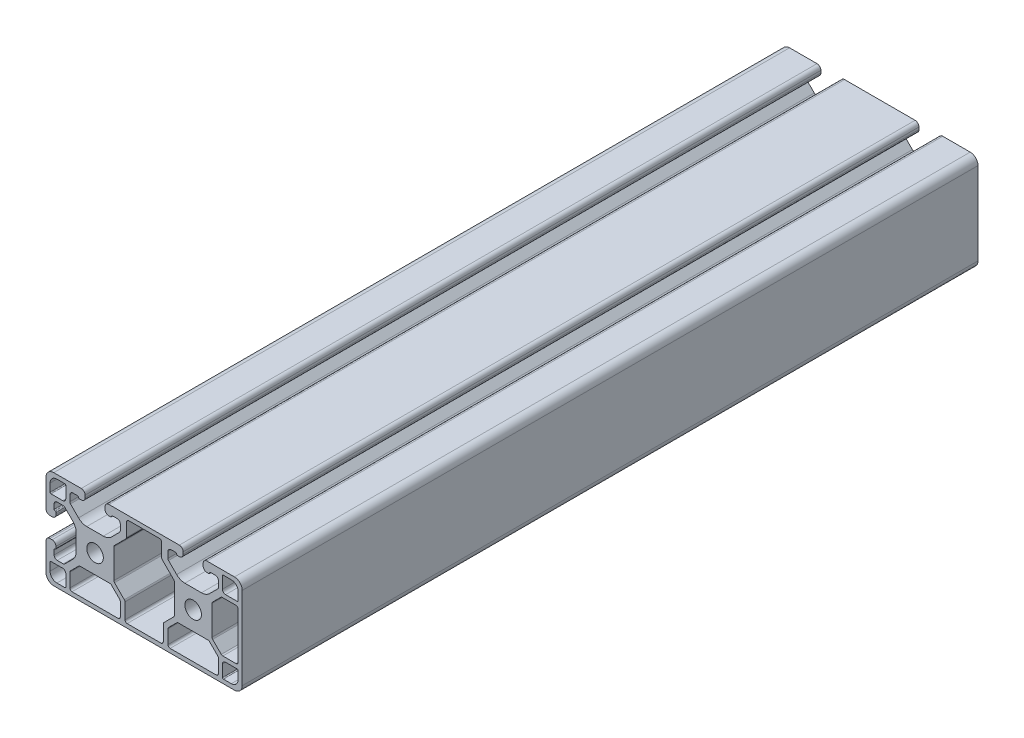
from build123d import *

# Parameters (mm, degrees)
SKETCH1_R      = 3.377777778
EXTRUDE1_DEPTH = 300


with BuildPart() as part:
    # Sketch1 → Extrude1 (new body)
    with BuildSketch(Plane.XY):
        with BuildLine():
            Line((16.825396825, 20), (5.638095238, 20))
            ThreePointArc((5.638095238, 20), (4.524682656, 19.538809408), (4.063492063, 18.425396825))
            Line((4.063492063, 18.425396825), (4.063492063, 17.511111111))
            ThreePointArc((4.063492063, 17.511111111), (4.524682656, 16.397698529), (5.638095238, 15.936507937))
            Line((5.638095238, 15.936507937), (6.344572699, 15.936507937))
            ThreePointArc((6.344572699, 15.936507937), (6.608509887, 16.043145483), (6.724293748, 16.303200291))
            Line((6.724293748, 16.303200291), (6.72528969, 16.331720344))
            ThreePointArc((6.72528969, 16.331720344), (6.84107355, 16.591775152), (7.105010739, 16.698412698))
            Line((7.105010739, 16.698412698), (9.015873016, 16.698412698))
            ThreePointArc((9.015873016, 16.698412698), (9.913786389, 16.326484802), (10.285714286, 15.428571429))
            Line((10.285714286, 15.428571429), (10.285714286, 12.988478889))
            ThreePointArc((10.285714286, 12.988478889), (10.218051648, 12.648315838), (10.025364758, 12.359939528))
            Line((10.025364758, 12.359939528), (6.738975247, 9.073550017))
            ThreePointArc((6.738975247, 9.073550017), (5.198221819, 8.04405149), (3.380779233, 7.682539683))
            Line((3.380779233, 7.682539683), (-3.380779233, 7.682539683))
            ThreePointArc((-3.380779233, 7.682539683), (-5.198221819, 8.04405149), (-6.738975247, 9.073550017))
            Line((-6.738975247, 9.073550017), (-10.025364758, 12.359939528))
            ThreePointArc((-10.025364758, 12.359939528), (-10.218051648, 12.648315838), (-10.285714286, 12.988478889))
            Line((-10.285714286, 12.988478889), (-10.285714286, 15.428571429))
            ThreePointArc((-10.285714286, 15.428571429), (-9.913786389, 16.326484802), (-9.015873016, 16.698412698))
            Line((-9.015873016, 16.698412698), (-7.105010739, 16.698412698))
            ThreePointArc((-7.105010739, 16.698412698), (-6.84107355, 16.591775152), (-6.72528969, 16.331720344))
            Line((-6.72528969, 16.331720344), (-6.724293748, 16.303200291))
            ThreePointArc((-6.724293748, 16.303200291), (-6.608509887, 16.043145483), (-6.344572699, 15.936507937))
            Line((-6.344572699, 15.936507937), (-5.638095238, 15.936507937))
            ThreePointArc((-5.638095238, 15.936507937), (-4.524682656, 16.397698529), (-4.063492063, 17.511111111))
            Line((-4.063492063, 17.511111111), (-4.063492063, 18.425396825))
            ThreePointArc((-4.063492063, 18.425396825), (-4.524682656, 19.538809408), (-5.638095238, 20))
            Line((-5.638095238, 20), (-34.361904762, 20))
            ThreePointArc((-34.361904762, 20), (-35.475317344, 19.538809408), (-35.936507937, 18.425396825))
            Line((-35.936507937, 18.425396825), (-35.936507937, 17.511111111))
            ThreePointArc((-35.936507937, 17.511111111), (-35.475317344, 16.397698529), (-34.361904762, 15.936507937))
            Line((-34.361904762, 15.936507937), (-33.655427301, 15.936507937))
            ThreePointArc((-33.655427301, 15.936507937), (-33.391490113, 16.043145483), (-33.275706252, 16.303200291))
            Line((-33.275706252, 16.303200291), (-33.27471031, 16.331720344))
            ThreePointArc((-33.27471031, 16.331720344), (-33.15892645, 16.591775152), (-32.894989261, 16.698412698))
            Line((-32.894989261, 16.698412698), (-30.984126984, 16.698412698))
            ThreePointArc((-30.984126984, 16.698412698), (-30.086213611, 16.326484802), (-29.714285714, 15.428571429))
            Line((-29.714285714, 15.428571429), (-29.714285714, 12.988478889))
            ThreePointArc((-29.714285714, 12.988478889), (-29.781948352, 12.648315838), (-29.974635242, 12.359939528))
            Line((-29.974635242, 12.359939528), (-33.261024753, 9.073550017))
            ThreePointArc((-33.261024753, 9.073550017), (-34.801778181, 8.04405149), (-36.619220767, 7.682539683))
            Line((-36.619220767, 7.682539683), (-43.380779233, 7.682539683))
            ThreePointArc((-43.380779233, 7.682539683), (-45.198221819, 8.04405149), (-46.738975247, 9.073550017))
            Line((-46.738975247, 9.073550017), (-50.025364758, 12.359939528))
            ThreePointArc((-50.025364758, 12.359939528), (-50.218051648, 12.648315838), (-50.285714286, 12.988478889))
            Line((-50.285714286, 12.988478889), (-50.285714286, 15.428571429))
            ThreePointArc((-50.285714286, 15.428571429), (-49.913786389, 16.326484802), (-49.015873016, 16.698412698))
            Line((-49.015873016, 16.698412698), (-47.105010739, 16.698412698))
            ThreePointArc((-47.105010739, 16.698412698), (-46.84107355, 16.591775152), (-46.72528969, 16.331720344))
            Line((-46.72528969, 16.331720344), (-46.724293748, 16.303200291))
            ThreePointArc((-46.724293748, 16.303200291), (-46.608509887, 16.043145483), (-46.344572699, 15.936507937))
            Line((-46.344572699, 15.936507937), (-45.638095238, 15.936507937))
            ThreePointArc((-45.638095238, 15.936507937), (-44.524682656, 16.397698529), (-44.063492063, 17.511111111))
            Line((-44.063492063, 17.511111111), (-44.063492063, 18.425396825))
            ThreePointArc((-44.063492063, 18.425396825), (-44.524682656, 19.538809408), (-45.638095238, 20))
            Line((-45.638095238, 20), (-56.825396825, 20))
            ThreePointArc((-56.825396825, 20), (-59.070180258, 19.070180258), (-60, 16.825396825))
            Line((-60, 16.825396825), (-60, 5.638095238))
            ThreePointArc((-60, 5.638095238), (-59.538809408, 4.524682656), (-58.425396825, 4.063492063))
            Line((-58.425396825, 4.063492063), (-57.511111111, 4.063492063))
            ThreePointArc((-57.511111111, 4.063492063), (-56.397698529, 4.524682656), (-55.936507937, 5.638095238))
            Line((-55.936507937, 5.638095238), (-55.936507937, 6.344572699))
            ThreePointArc((-55.936507937, 6.344572699), (-56.043145483, 6.608509887), (-56.303200291, 6.724293748))
            Line((-56.303200291, 6.724293748), (-56.331720344, 6.72528969))
            ThreePointArc((-56.331720344, 6.72528969), (-56.591775152, 6.84107355), (-56.698412698, 7.105010739))
            Line((-56.698412698, 7.105010739), (-56.698412698, 9.015873016))
            ThreePointArc((-56.698412698, 9.015873016), (-56.326484802, 9.913786389), (-55.428571429, 10.285714286))
            Line((-55.428571429, 10.285714286), (-52.988478889, 10.285714286))
            ThreePointArc((-52.988478889, 10.285714286), (-52.648315838, 10.218051648), (-52.359939528, 10.025364758))
            Line((-52.359939528, 10.025364758), (-49.073550017, 6.738975247))
            ThreePointArc((-49.073550017, 6.738975247), (-48.04405149, 5.198221819), (-47.682539683, 3.380779233))
            Line((-47.682539683, 3.380779233), (-47.682539683, -3.380779233))
            ThreePointArc((-47.682539683, -3.380779233), (-48.04405149, -5.198221819), (-49.073550017, -6.738975247))
            Line((-49.073550017, -6.738975247), (-52.359939528, -10.025364758))
            ThreePointArc((-52.359939528, -10.025364758), (-52.648315838, -10.218051648), (-52.988478889, -10.285714286))
            Line((-52.988478889, -10.285714286), (-55.428571429, -10.285714286))
            ThreePointArc((-55.428571429, -10.285714286), (-56.326484802, -9.913786389), (-56.698412698, -9.015873016))
            Line((-56.698412698, -9.015873016), (-56.698412698, -7.105010739))
            ThreePointArc((-56.698412698, -7.105010739), (-56.591775152, -6.84107355), (-56.331720344, -6.72528969))
            Line((-56.331720344, -6.72528969), (-56.303200291, -6.724293748))
            ThreePointArc((-56.303200291, -6.724293748), (-56.043145483, -6.608509887), (-55.936507937, -6.344572699))
            Line((-55.936507937, -6.344572699), (-55.936507937, -5.638095238))
            ThreePointArc((-55.936507937, -5.638095238), (-56.397698529, -4.524682656), (-57.511111111, -4.063492063))
            Line((-57.511111111, -4.063492063), (-58.425396825, -4.063492063))
            ThreePointArc((-58.425396825, -4.063492063), (-59.538809408, -4.524682656), (-60, -5.638095238))
            Line((-60, -5.638095238), (-60, -16.825396825))
            ThreePointArc((-60, -16.825396825), (-59.070180258, -19.070180258), (-56.825396825, -20))
            Line((-56.825396825, -20), (16.825396825, -20))
            ThreePointArc((16.825396825, -20), (19.070180258, -19.070180258), (20, -16.825396825))
            Line((20, -16.825396825), (20, 16.825396825))
            ThreePointArc((20, 16.825396825), (19.070180258, 19.070180258), (16.825396825, 20))
        make_face()
        Circle(SKETCH1_R, mode=Mode.SUBTRACT)
        with Locations((-40, 0)):
            Circle(SKETCH1_R, mode=Mode.SUBTRACT)
        with BuildLine():
            Line((-57.969507937, -11.936507937), (-53.206349206, -11.936507937))
            ThreePointArc((-53.206349206, -11.936507937), (-52.308435833, -12.308435833), (-51.936507937, -13.206349206))
            Line((-51.936507937, -13.206349206), (-51.936507937, -17.969253843))
            ThreePointArc((-51.936507937, -17.969253843), (-52.047793449, -18.237920837), (-52.316460442, -18.349206349))
            Line((-52.316460442, -18.349206349), (-55.555507937, -18.349206349))
            ThreePointArc((-55.555507937, -18.349206349), (-57.531164283, -17.530862696), (-58.349507937, -15.555206349))
            Line((-58.349507937, -15.555206349), (-58.349507937, -12.316507937))
            ThreePointArc((-58.349507937, -12.316507937), (-58.238208513, -12.04780736), (-57.969507937, -11.936507937))
        make_face(mode=Mode.SUBTRACT)
        with BuildLine():
            Line((-53.206349206, 11.936507937), (-57.969507937, 11.936507937))
            ThreePointArc((-57.969507937, 11.936507937), (-58.238208513, 12.04780736), (-58.349507937, 12.316507937))
            Line((-58.349507937, 12.316507937), (-58.349507937, 15.555206349))
            ThreePointArc((-58.349507937, 15.555206349), (-57.531164283, 17.530862696), (-55.555507937, 18.349206349))
            Line((-55.555507937, 18.349206349), (-52.316460442, 18.349206349))
            ThreePointArc((-52.316460442, 18.349206349), (-52.047793449, 18.237920837), (-51.936507937, 17.969253843))
            Line((-51.936507937, 17.969253843), (-51.936507937, 13.206349206))
            ThreePointArc((-51.936507937, 13.206349206), (-52.308435833, 12.308435833), (-53.206349206, 11.936507937))
        make_face(mode=Mode.SUBTRACT)
        with BuildLine():
            Line((13.206349206, -11.936507937), (17.969507937, -11.936507937))
            ThreePointArc((17.969507937, -11.936507937), (18.238208513, -12.04780736), (18.349507937, -12.316507937))
            Line((18.349507937, -12.316507937), (18.349507937, -15.555206349))
            ThreePointArc((18.349507937, -15.555206349), (17.531164283, -17.530862696), (15.555507937, -18.349206349))
            Line((15.555507937, -18.349206349), (12.316460442, -18.349206349))
            ThreePointArc((12.316460442, -18.349206349), (12.047793449, -18.237920837), (11.936507937, -17.969253843))
            Line((11.936507937, -17.969253843), (11.936507937, -13.206349206))
            ThreePointArc((11.936507937, -13.206349206), (12.308435833, -12.308435833), (13.206349206, -11.936507937))
        make_face(mode=Mode.SUBTRACT)
        with BuildLine():
            Line((17.969507937, 11.936507937), (13.206349206, 11.936507937))
            ThreePointArc((13.206349206, 11.936507937), (12.308435833, 12.308435833), (11.936507937, 13.206349206))
            Line((11.936507937, 13.206349206), (11.936507937, 17.969253843))
            ThreePointArc((11.936507937, 17.969253843), (12.047793449, 18.237920837), (12.316460442, 18.349206349))
            Line((12.316460442, 18.349206349), (15.555507937, 18.349206349))
            ThreePointArc((15.555507937, 18.349206349), (17.531164283, 17.530862696), (18.349507937, 15.555206349))
            Line((18.349507937, 15.555206349), (18.349507937, 12.316507937))
            ThreePointArc((18.349507937, 12.316507937), (18.238208513, 12.04780736), (17.969507937, 11.936507937))
        make_face(mode=Mode.SUBTRACT)
        with BuildLine():
            Line((-30.603174603, -18.349206349), (-49.396825397, -18.349206349))
            ThreePointArc((-49.396825397, -18.349206349), (-50.025364758, -18.088856821), (-50.285714286, -17.46031746))
            Line((-50.285714286, -17.46031746), (-50.285714286, -11.910982841))
            ThreePointArc((-50.285714286, -11.910982841), (-50.218051648, -11.57081979), (-50.025364758, -11.28244348))
            Line((-50.025364758, -11.28244348), (-46.685810488, -7.94288921))
            ThreePointArc((-46.685810488, -7.94288921), (-46.397434178, -7.75020232), (-46.057271127, -7.682539683))
            Line((-46.057271127, -7.682539683), (-33.942728873, -7.682539683))
            ThreePointArc((-33.942728873, -7.682539683), (-33.602565822, -7.75020232), (-33.314189512, -7.94288921))
            Line((-33.314189512, -7.94288921), (-29.974635242, -11.28244348))
            ThreePointArc((-29.974635242, -11.28244348), (-29.781948352, -11.57081979), (-29.714285714, -11.910982841))
            Line((-29.714285714, -11.910982841), (-29.714285714, -17.46031746))
            ThreePointArc((-29.714285714, -17.46031746), (-29.974635242, -18.088856821), (-30.603174603, -18.349206349))
        make_face(mode=Mode.SUBTRACT)
        with BuildLine():
            Line((-28.069873337, -10.493465266), (-32.05711079, -6.506227814))
            ThreePointArc((-32.05711079, -6.506227814), (-32.24979768, -6.217851504), (-32.317460317, -5.877688453))
            Line((-32.317460317, -5.877688453), (-32.317460317, 6.057271127))
            ThreePointArc((-32.317460317, 6.057271127), (-32.24979768, 6.397434178), (-32.05711079, 6.685810488))
            Line((-32.05711079, 6.685810488), (-27.434952702, 11.307968575))
            ThreePointArc((-27.434952702, 11.307968575), (-27.242265812, 11.596344886), (-27.174603175, 11.936507937))
            Line((-27.174603175, 11.936507937), (-27.174603175, 17.421618969))
            ThreePointArc((-27.174603175, 17.421618969), (-26.914253647, 18.05015833), (-26.285714286, 18.310507858))
            Line((-26.285714286, 18.310507858), (-13.714285714, 18.310507858))
            ThreePointArc((-13.714285714, 18.310507858), (-13.085746353, 18.05015833), (-12.825396825, 17.421618969))
            Line((-12.825396825, 17.421618969), (-12.825396825, 11.936507937))
            ThreePointArc((-12.825396825, 11.936507937), (-12.757734188, 11.596344886), (-12.565047298, 11.307968575))
            Line((-12.565047298, 11.307968575), (-7.94288921, 6.685810488))
            ThreePointArc((-7.94288921, 6.685810488), (-7.75020232, 6.397434178), (-7.682539683, 6.057271127))
            Line((-7.682539683, 6.057271127), (-7.682539683, -5.877688453))
            ThreePointArc((-7.682539683, -5.877688453), (-7.75020232, -6.217851504), (-7.94288921, -6.506227814))
            Line((-7.94288921, -6.506227814), (-11.930126663, -10.493465266))
            ThreePointArc((-11.930126663, -10.493465266), (-12.122813553, -10.781841576), (-12.19047619, -11.122004627))
            Line((-12.19047619, -11.122004627), (-12.19047619, -17.46031746))
            ThreePointArc((-12.19047619, -17.46031746), (-12.450825718, -18.088856821), (-13.079365079, -18.349206349))
            Line((-13.079365079, -18.349206349), (-26.920634921, -18.349206349))
            ThreePointArc((-26.920634921, -18.349206349), (-27.549174282, -18.088856821), (-27.80952381, -17.46031746))
            Line((-27.80952381, -17.46031746), (-27.80952381, -11.122004627))
            ThreePointArc((-27.80952381, -11.122004627), (-27.877186447, -10.781841576), (-28.069873337, -10.493465266))
        make_face(mode=Mode.SUBTRACT)
        with BuildLine():
            Line((6.685843032, -7.942921754), (10.025332214, -11.282410936))
            ThreePointArc((10.025332214, -11.282410936), (10.21804319, -11.570823293), (10.285714286, -11.911028865))
            Line((10.285714286, -11.911028865), (10.285714286, -17.46031746))
            ThreePointArc((10.285714286, -17.46031746), (10.025364758, -18.088856821), (9.396825397, -18.349206349))
            Line((9.396825397, -18.349206349), (-9.396825397, -18.349206349))
            ThreePointArc((-9.396825397, -18.349206349), (-10.025364758, -18.088856821), (-10.285714286, -17.46031746))
            Line((-10.285714286, -17.46031746), (-10.285714286, -11.910982841))
            ThreePointArc((-10.285714286, -11.910982841), (-10.218051648, -11.57081979), (-10.025364758, -11.28244348))
            Line((-10.025364758, -11.28244348), (-6.685810488, -7.94288921))
            ThreePointArc((-6.685810488, -7.94288921), (-6.397434178, -7.75020232), (-6.057271127, -7.682539683))
            Line((-6.057271127, -7.682539683), (6.057225103, -7.682539683))
            ThreePointArc((6.057225103, -7.682539683), (6.397430675, -7.750210778), (6.685843032, -7.942921754))
        make_face(mode=Mode.SUBTRACT)
        with BuildLine():
            Line((11.461993611, -10.025332214), (7.942921754, -6.506260357))
            ThreePointArc((7.942921754, -6.506260357), (7.750210778, -6.217848), (7.682539683, -5.877642429))
            Line((7.682539683, -5.877642429), (7.682539683, 6.057271127))
            ThreePointArc((7.682539683, 6.057271127), (7.75020232, 6.397434178), (7.94288921, 6.685810488))
            Line((7.94288921, 6.685810488), (11.28244348, 10.025364758))
            ThreePointArc((11.28244348, 10.025364758), (11.57081979, 10.218051648), (11.910982841, 10.285714286))
            Line((11.910982841, 10.285714286), (17.421618969, 10.285714286))
            ThreePointArc((17.421618969, 10.285714286), (18.05015833, 10.025364758), (18.310507858, 9.396825397))
            Line((18.310507858, 9.396825397), (18.310507858, -9.396825397))
            ThreePointArc((18.310507858, -9.396825397), (18.05015833, -10.025364758), (17.421618969, -10.285714286))
            Line((17.421618969, -10.285714286), (12.090611539, -10.285714286))
            ThreePointArc((12.090611539, -10.285714286), (11.750405968, -10.21804319), (11.461993611, -10.025332214))
        make_face(mode=Mode.SUBTRACT)
    extrude(amount=-EXTRUDE1_DEPTH)


solid = part.part
